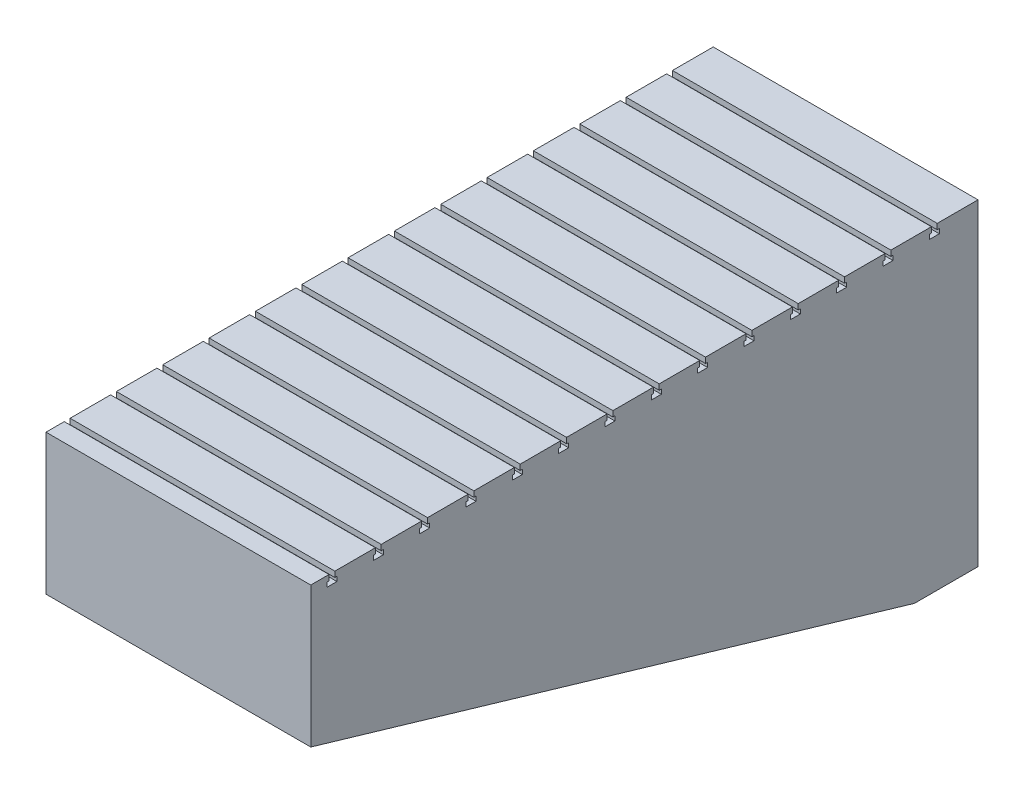
from build123d import *

# Parameters (mm, degrees)
BOSS_EXTRUDE1_DEPTH = 1000
CUT_EXTRUDE1_REACH  = 2966.861
LPATTERN1_COUNT     = 14
LPATTERN1_PITCH     = 175


with BuildPart() as part:
    # Sketch4 → Boss-Extrude1 (new body)
    with BuildSketch(Plane(origin=(0, 0, 0), x_dir=(0, 0, -1), z_dir=(1, 0, 0))):
        Polygon((0, 0), (-2520, 0), (-2520, -530), (-240, -1200), (0, -1200), align=None)
    extrude(amount=BOSS_EXTRUDE1_DEPTH)

    # Sketch6 → Cut-Extrude1 (cut, up to next)
    with BuildSketch(Plane(origin=(0, 0, 0), x_dir=(0, 0, -1), z_dir=(1, 0, 0)), mode=Mode.PRIVATE) as cut_extrude1_sk1:
        Polygon((-154, 0), (-176, 0), (-176, -21), (-183.9, -21), (-183.9, -38), (-146.1, -38), (-146.1, -21), (-154, -21), align=None)
    cut_extrude1_tool1 = extrude(cut_extrude1_sk1.sketch, amount=CUT_EXTRUDE1_REACH, mode=Mode.PRIVATE) & part.part
    cut_extrude1 = cut_extrude1_tool1.solids().sort_by_distance((0, -21.553232, 165))[0]
    add(cut_extrude1, mode=Mode.SUBTRACT)

    # LPattern1: Cut-Extrude1 ×14
    with Locations(*[(0, 0, i * LPATTERN1_PITCH) for i in range(1, LPATTERN1_COUNT)]):
        add(cut_extrude1, mode=Mode.SUBTRACT)


solid = part.part
